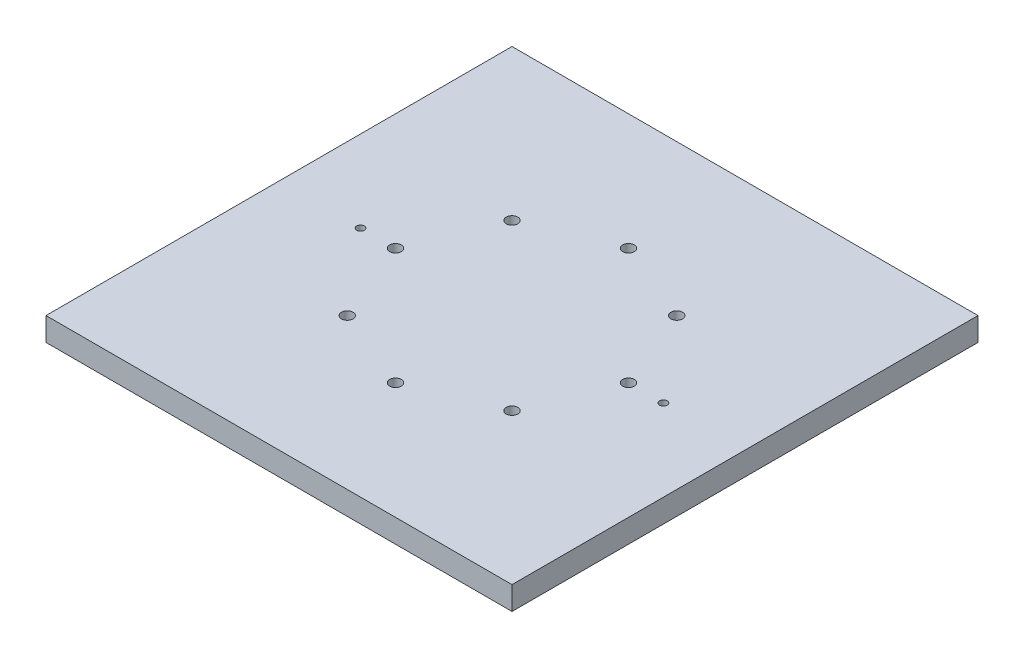
from build123d import *

# Parameters (mm, degrees)
SKETCH1_W               = 254
SKETCH1_H               = 254
BOSS_EXTRUDE1_DEPTH     = 12.7
CUT_EXTRUDE2_DEPTH      = 181.05357536
CUT_EXTRUDE2_DEPTH_BACK = 181.05357536
SKETCH6_R               = 3.175
CUT_EXTRUDE3_DEPTH      = 181.05357536
CUT_EXTRUDE3_DEPTH_BACK = 181.05357536
SKETCH7_R               = 2.0828


with BuildPart() as part:
    # Sketch1 → Boss-Extrude1 (new body)
    with BuildSketch(Plane(origin=(0, 0, 0), x_dir=(1, 0, 0), z_dir=(0, 1, 0))):
        Rectangle(SKETCH1_W, SKETCH1_H)
    extrude(amount=BOSS_EXTRUDE1_DEPTH)

    # Sketch6 → Cut-Extrude2 (cut, two sides: drawn at the far end of the back side and taken through both)
    with BuildSketch(Plane(origin=(0, 12.7, 0), x_dir=(1, 0, 0), z_dir=(0, 1, 0)).offset(-CUT_EXTRUDE2_DEPTH_BACK)):
        with Locations(Location((0, 63.5, 0), (0, 0, 270))):
            Circle(SKETCH6_R)
        with Locations(Location((44.901280605, 44.901280605, 0), (0, 0, 270))):
            Circle(SKETCH6_R)
        with Locations(Location((63.5, 0, 0), (0, 0, 270))):
            Circle(SKETCH6_R)
        with Locations(Location((44.901280605, -44.901280605, 0), (0, 0, 270))):
            Circle(SKETCH6_R)
        with Locations(Location((0, -63.5, 0), (0, 0, 270))):
            Circle(SKETCH6_R)
        with Locations(Location((-44.901280605, -44.901280605, 0), (0, 0, 270))):
            Circle(SKETCH6_R)
        with Locations(Location((-63.5, 0, 0), (0, 0, 270))):
            Circle(SKETCH6_R)
        with Locations(Location((-44.901280605, 44.901280605, 0), (0, 0, 270))):
            Circle(SKETCH6_R)
    extrude(amount=CUT_EXTRUDE2_DEPTH + CUT_EXTRUDE2_DEPTH_BACK, mode=Mode.SUBTRACT)

    # Sketch7 → Cut-Extrude3 (cut, two sides: drawn at the far end of the back side and taken through both)
    with BuildSketch(Plane(origin=(0, 12.7, 0), x_dir=(1, 0, 0), z_dir=(0, 1, 0)).offset(-CUT_EXTRUDE3_DEPTH_BACK)):
        with Locations(Location((-82.55, 0, 0), (0, 0, 270))):
            Circle(SKETCH7_R)
        with Locations(Location((82.55, 0, 0), (0, 0, 270))):
            Circle(SKETCH7_R)
    extrude(amount=CUT_EXTRUDE3_DEPTH + CUT_EXTRUDE3_DEPTH_BACK, mode=Mode.SUBTRACT)


solid = part.part
